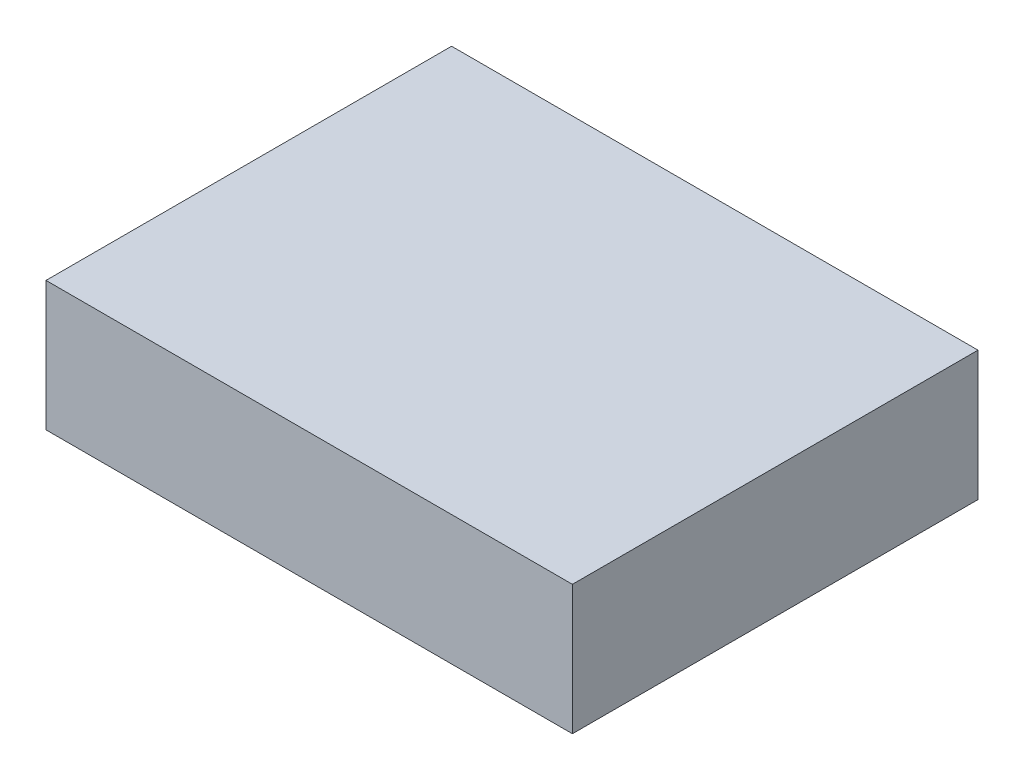
from build123d import *

# Parameters (mm, degrees)
SKETCH_1_W      = 61
SKETCH_1_H      = 47
EXTRUDE_1_DEPTH = 15


with BuildPart() as part:
    # 草图1 → 凸台-拉伸1 (new body)
    with BuildSketch(Plane(origin=(0, 0, 0), x_dir=(1, 0, 0), z_dir=(0, 1, 0))):
        with Locations((30.5, 23.5)):
            Rectangle(SKETCH_1_W, SKETCH_1_H)
    extrude(amount=EXTRUDE_1_DEPTH)


solid = part.part
